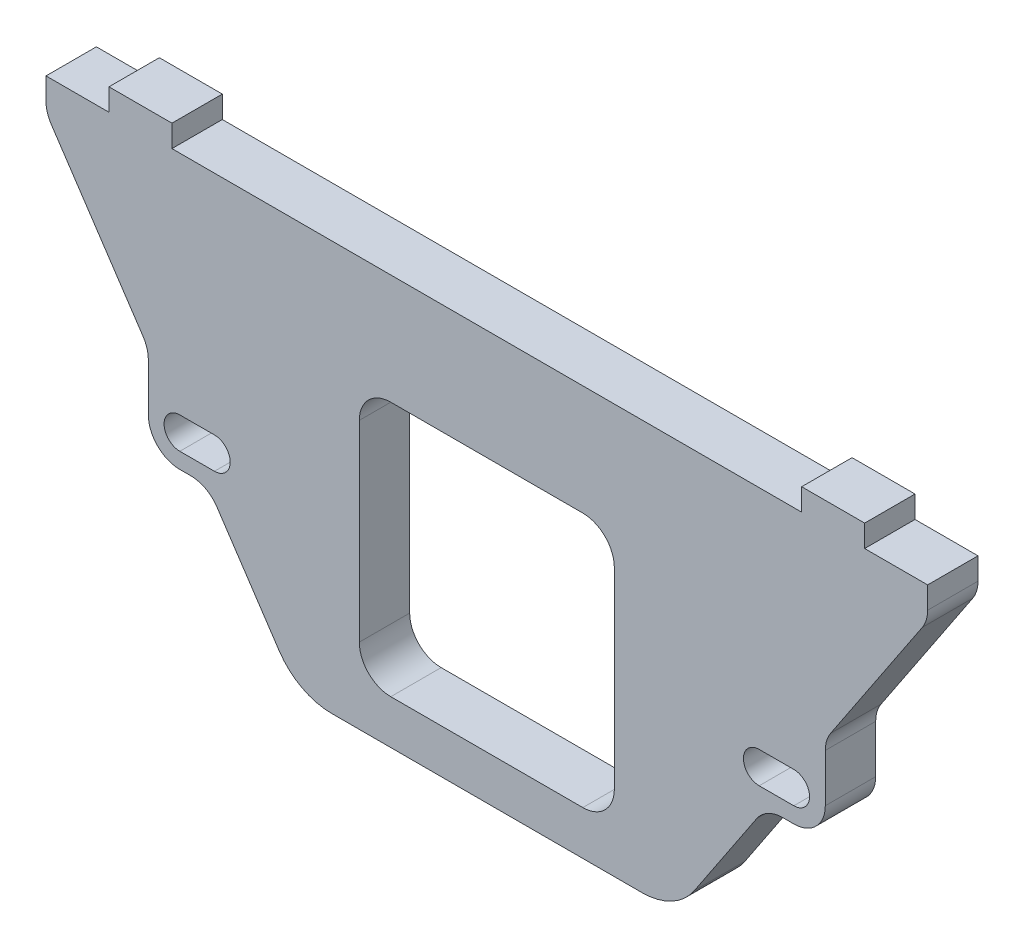
from build123d import *

# Parameters (mm, degrees)
SKETCH_1_W          = 81
SKETCH_1_H          = 81
EXTRUDE_1_DEPTH     = 8
FILLET_1_R          = 10
CUT_EXTRUDE_1_DEPTH = 16
FILLET_2_R          = 20
FILLET_3_R          = 10


with BuildPart() as part:
    # 草图1 → 凸台-拉伸1 (new, symmetric)
    with BuildSketch(Plane.XY):
        Polygon((60, 0), (-60, 0), (-88.666666667, 43), (-107.5, 43), (-107.5, 71.25), (-140, 120), (-140, 130), (-120, 130), (-120, 137), (-100, 137), (-100, 130), (100, 130), (100, 137), (120, 137), (120, 130), (140, 130), (140, 120), (107.5, 71.25), (107.5, 43), (88.666666667, 43), align=None)
        with Locations((0, 54.5)):
            Rectangle(SKETCH_1_W, SKETCH_1_H, mode=Mode.SUBTRACT)
    extrude(amount=EXTRUDE_1_DEPTH, both=True)

    # 圆角1
    fillet_1_edges = [part.edges().sort_by_distance(p)[0] for p in [
        (-107.5, 43, 0),
        (107.5, 43, 0),
        (40.5, 14, 0),
        (40.5, 95, 0),
        (-40.5, 95, 0),
        (-40.5, 14, 0),
    ]]
    fillet(fillet_1_edges, radius=FILLET_1_R)

    # 草图2 → 切除-拉伸1 (cut)
    with BuildSketch(Plane.XY.offset(8)):
        with BuildLine():
            Line((-97.5, 58), (-86.5, 58))
            ThreePointArc((-86.5, 58), (-81.5, 53), (-86.5, 48))
            Line((-86.5, 48), (-97.5, 48))
            ThreePointArc((-97.5, 48), (-102.5, 53), (-97.5, 58))
        make_face()
        with BuildLine():
            Line((97.5, 48), (86.5, 48))
            ThreePointArc((86.5, 48), (81.5, 53), (86.5, 58))
            Line((86.5, 58), (97.5, 58))
            ThreePointArc((97.5, 58), (102.5, 53), (97.5, 48))
        make_face()
    extrude(amount=-CUT_EXTRUDE_1_DEPTH, mode=Mode.SUBTRACT)

    # 圆角2
    fillet_2_edges = [part.edges().sort_by_distance(p)[0] for p in [
        (60, 0, 0),
        (-60, 0, 0),
    ]]
    fillet(fillet_2_edges, radius=FILLET_2_R)

    # 圆角3
    fillet_3_edges = [part.edges().sort_by_distance(p)[0] for p in [
        (-88.666666667, 43, 0),
        (-107.5, 71.25, 0),
        (-140, 120, 0),
        (140, 120, 0),
        (107.5, 71.25, 0),
        (88.666666667, 43, 0),
    ]]
    fillet(fillet_3_edges, radius=FILLET_3_R)


solid = part.part
